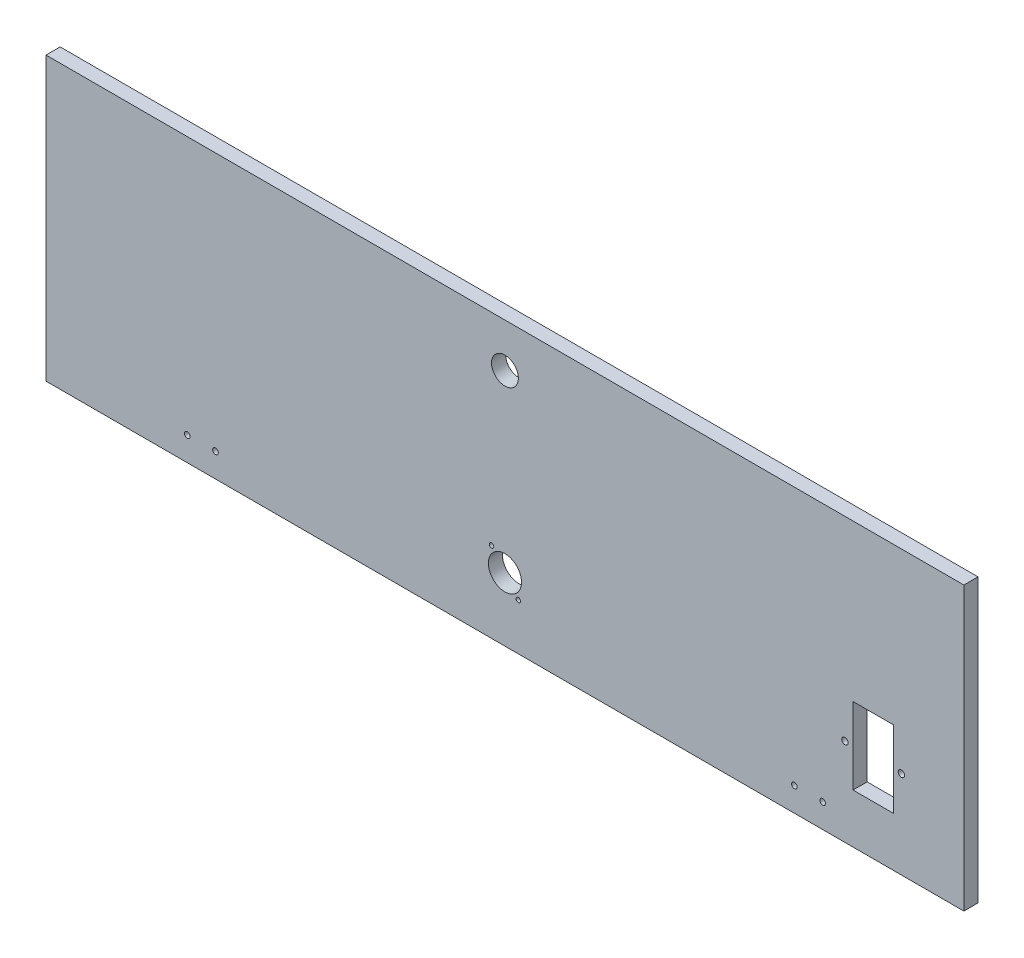
from build123d import *

# Parameters (mm, degrees)
ESQUISSE1_W             = 650
ESQUISSE1_H             = 200
BOSS_EXTRU_1_DEPTH      = 10
ESQUISSE2_R             = 2
ENL_V_MAT_EXTRU_1_DEPTH = 10
ESQUISSE3_R             = 1.6
ESQUISSE3_R_2           = 11.75
ESQUISSE3_W             = 28.5
ESQUISSE3_H             = 54.3
ESQUISSE3_R_3           = 2.25
ENL_V_MAT_EXTRU_2_DEPTH = 10
ESQUISSE4_R             = 9.5
ENL_V_MAT_EXTRU_3_DEPTH = 10
ESQUISSE5_R             = 1
ENL_V_MAT_EXTRU_4_DEPTH = 2


with BuildPart() as part:
    # Esquisse1 → Boss.-Extru.1 (new body)
    with BuildSketch(Plane.XY):
        with Locations((325, 100)):
            Rectangle(ESQUISSE1_W, ESQUISSE1_H)
    extrude(amount=BOSS_EXTRU_1_DEPTH)

    # Esquisse2 → Enlèv. mat.-Extru.1 (cut)
    with BuildSketch(Plane.XY.offset(10)):
        with Locations((100, 17)):
            Circle(ESQUISSE2_R)
        with Locations((120, 17)):
            Circle(ESQUISSE2_R)
        with Locations((530, 17)):
            Circle(ESQUISSE2_R)
        with Locations((550, 17)):
            Circle(ESQUISSE2_R)
    extrude(amount=-ENL_V_MAT_EXTRU_1_DEPTH, mode=Mode.SUBTRACT)

    # Esquisse3 → Enlèv. mat.-Extru.2 (cut)
    with BuildSketch(Plane.XY.offset(10)):
        with Locations((315.499614794, 56.999404399)):
            Circle(ESQUISSE3_R)
        with Locations((325, 45)):
            Circle(ESQUISSE3_R_2)
        with Locations((334.500385206, 33.000595601)):
            Circle(ESQUISSE3_R)
        with Locations((585.75, 62.15)):
            Rectangle(ESQUISSE3_W, ESQUISSE3_H)
        with Locations((565.75, 62.15)):
            Circle(ESQUISSE3_R_3)
        with Locations((605.75, 62.15)):
            Circle(ESQUISSE3_R_3)
    extrude(amount=-ENL_V_MAT_EXTRU_2_DEPTH, mode=Mode.SUBTRACT)

    # Esquisse4 → Enlèv. mat.-Extru.3 (cut)
    with BuildSketch(Plane.XY.offset(10)):
        with Locations((325, 169)):
            Circle(ESQUISSE4_R)
    extrude(amount=-ENL_V_MAT_EXTRU_3_DEPTH, mode=Mode.SUBTRACT)

    # Esquisse5 → Enlèv. mat.-Extru.4 (cut)
    with BuildSketch(Plane.XY):
        with Locations((341, 169)):
            Circle(ESQUISSE5_R)
        with Locations((309, 169)):
            Circle(ESQUISSE5_R)
        with Locations((125, 193)):
            Circle(ESQUISSE5_R)
        with Locations((105, 193)):
            Circle(ESQUISSE5_R)
        with Locations((545, 193)):
            Circle(ESQUISSE5_R)
        with Locations((525, 193)):
            Circle(ESQUISSE5_R)
    extrude(amount=ENL_V_MAT_EXTRU_4_DEPTH, mode=Mode.SUBTRACT)


solid = part.part
